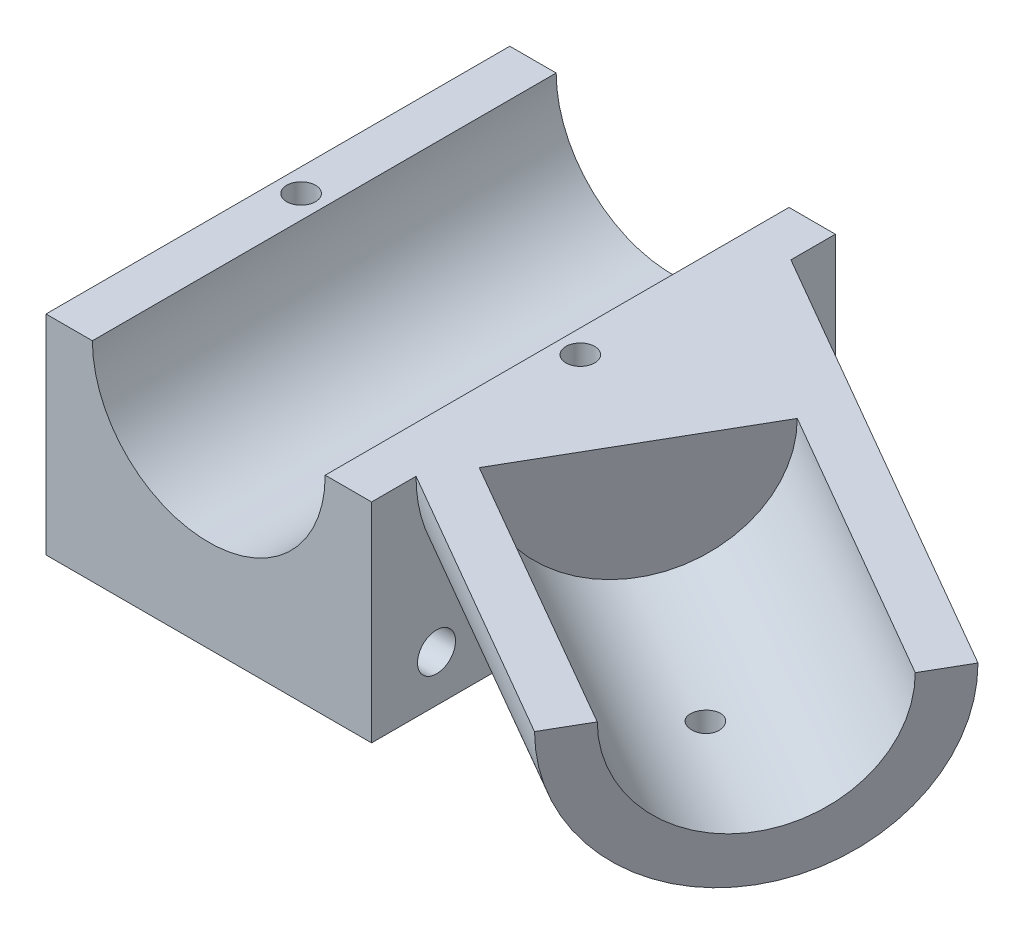
from build123d import *

# Parameters (mm, degrees)
BOSS_EXTRUDE1_DEPTH             = 25
SKETCH2_R                       = 1.55
CUT_EXTRUDE1_DEPTH              = 22.5
BOSS_EXTRUDE2_REACH             = 65.436
BOSS_EXTRUDE2_DIRECTION_2_DEPTH = 30
CUT_EXTRUDE2_REACH              = 80.642
CUT_EXTRUDE2_END_RADIUS         = 17.5
SKETCH7_R                       = 1.55
SKETCH9_R                       = 2.05
CUT_EXTRUDE3_DEPTH              = 35.1
BOSS_EXTRUDE5_REACH             = 63.632


with BuildPart() as part:
    # Sketch1 → Boss-Extrude1 (new, symmetric)
    with BuildSketch(Plane.XY):
        with BuildLine():
            Line((-17.55, 22.5), (-17.55, 0))
            Line((-17.55, 0), (17.55, 0))
            Line((17.55, 0), (17.55, 22.5))
            Line((17.55, 22.5), (12.55, 22.5))
            ThreePointArc((12.55, 22.5), (0, 9.95), (-12.55, 22.5))
            Line((-12.55, 22.5), (-17.55, 22.5))
        make_face()
    extrude(amount=BOSS_EXTRUDE1_DEPTH, both=True)

    # Sketch2 → Cut-Extrude1 (cut)
    with BuildSketch(Plane(origin=(0, 22.5, 0), x_dir=(1, 0, 0), z_dir=(0, 1, 0))):
        with Locations(Location((-15.05, 0, 0), (0, 0, 270))):
            Circle(SKETCH2_R)
        with Locations(Location((15.05, 0, 0), (0, 0, 270))):
            Circle(SKETCH2_R)
    extrude(amount=-CUT_EXTRUDE1_DEPTH, mode=Mode.SUBTRACT)

    # Boss-Extrude2: up to this plane
    boss_extrude2_end = Plane(origin=(17.55, 0, 25), z_dir=(-1, 0, 0))
    # Sketch5 → Boss-Extrude2 (add, up to the surface)
    with BuildSketch(Plane(origin=(26.152881057, 0, 15.099372918), x_dir=(0.500000000000001, 0, -0.8660254037844382), z_dir=(0.8660254037844382, 0, 0.500000000000001)), mode=Mode.PRIVATE) as boss_extrude2_sk1:
        with BuildLine():
            Line((-8.725, 22.5), (-3.775, 22.5))
            ThreePointArc((-3.775, 22.5), (8.775, 9.95), (21.325, 22.5))
            Line((21.325, 22.5), (26.275, 22.5))
            ThreePointArc((26.275, 22.5), (8.775, 5), (-8.725, 22.5))
        make_face()
    boss_extrude2_tool1 = split(extrude(boss_extrude2_sk1.sketch, amount=-BOSS_EXTRUDE2_REACH, mode=Mode.PRIVATE), bisect_by=boss_extrude2_end, keep=Keep.BOTH, mode=Mode.PRIVATE)
    add(boss_extrude2_tool1.solids().sort_by_distance((23.027881, 22.108688, 20.512032))[0])

    # Sketch5 → Boss-Extrude2 direction 2 (add)
    with BuildSketch(Plane(origin=(26.152881057, 0, 15.099372918), x_dir=(0.500000000000001, 0, -0.8660254037844382), z_dir=(0.8660254037844382, 0, 0.500000000000001))):
        with BuildLine():
            Line((-8.725, 22.5), (-3.775, 22.5))
            ThreePointArc((-3.775, 22.5), (8.775, 9.95), (21.325, 22.5))
            Line((21.325, 22.5), (26.275, 22.5))
            ThreePointArc((26.275, 22.5), (8.775, 5), (-8.725, 22.5))
        make_face()
    extrude(amount=BOSS_EXTRUDE2_DIRECTION_2_DEPTH)

    # Cut-Extrude2: up to this cylinder (the profile starts inside it)
    cut_extrude2_end = Plane(origin=(43.530762028, 22.5, 14.999999951), z_dir=(-0.8660254037844382, 0, -0.500000000000001)) * Cylinder(CUT_EXTRUDE2_END_RADIUS, 197.284, mode=Mode.PRIVATE)
    # Sketch7 → Cut-Extrude2 (cut, up to the surface)
    with BuildSketch(Plane(origin=(0, 22.5, 0), x_dir=(1, 0, 0), z_dir=(0, 1, 0)), mode=Mode.PRIVATE) as cut_extrude2_sk1:
        with Locations(Location((43.530762114, -15, 0), (0, 0, 180))):
            Circle(SKETCH7_R)
    cut_extrude2_tool1 = extrude(cut_extrude2_sk1.sketch, amount=-CUT_EXTRUDE2_REACH, mode=Mode.PRIVATE) & cut_extrude2_end
    add(cut_extrude2_tool1.solids().sort_by_distance((43.530762, 22.5, 15))[0], mode=Mode.SUBTRACT)

    # Sketch9 → Cut-Extrude3 (cut)
    with BuildSketch(Plane.ZY.offset(17.55)):
        with Locations((-18, 5)):
            Circle(SKETCH9_R)
        with Locations((18, 5)):
            Circle(SKETCH9_R)
    extrude(amount=-CUT_EXTRUDE3_DEPTH, mode=Mode.SUBTRACT)

    # Boss-Extrude5: up to this face of the body (flat: up to its plane)
    boss_extrude5_end = Plane(part.part.faces().sort_by_distance((17.55, 17.173614571, 0))[0])
    # Sketch12 → Boss-Extrude5 (add, up to the picked face)
    with BuildSketch(Plane(origin=(22.035576211, 0, 12.722245857), x_dir=(0.4999999999999999, 0, -0.8660254037844388), z_dir=(0.8660254037844388, 0, 0.4999999999999999)), mode=Mode.PRIVATE) as boss_extrude5_sk1:
        with BuildLine():
            Line((-3.775, 22.5), (21.325, 22.5))
            ThreePointArc((21.325, 22.5), (8.775, 9.95), (-3.775, 22.5))
        make_face()
    boss_extrude5_tool1 = split(extrude(boss_extrude5_sk1.sketch, amount=-BOSS_EXTRUDE5_REACH, mode=Mode.PRIVATE), bisect_by=boss_extrude5_end, keep=Keep.BOTH, mode=Mode.PRIVATE)
    add(boss_extrude5_tool1.solids().sort_by(Axis((26.423076, 17.173615, 5.122873), (-0.8660254037844388, 0, -0.4999999999999999)))[0])


solid = part.part
